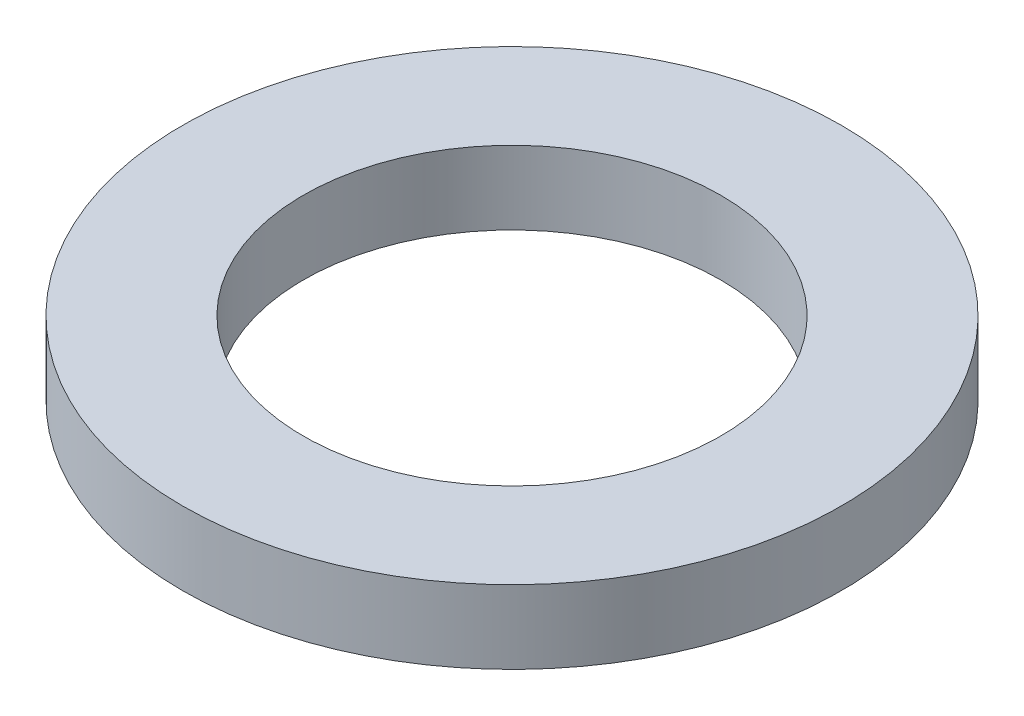
from build123d import *

# Parameters (mm, degrees)
SKIZZE1_W = 8.4
SKIZZE1_H = 5.1


with BuildPart() as part:
    # Skizze1 → Rotation1 (revolve)
    with BuildSketch(Plane(origin=(0, 0, 0), x_dir=(0, 0, -1), z_dir=(1, 0, 0)), mode=Mode.PRIVATE) as rotation1_sk:
        with Locations((-18.7, 100.846234849)):
            Rectangle(SKIZZE1_W, SKIZZE1_H)
    revolve(rotation1_sk.sketch.rotate(Axis((0, 0, 0), (0, 1, 0)), 180), axis=Axis((0, 0, 0), (0, 1, 0)))


solid = part.part
